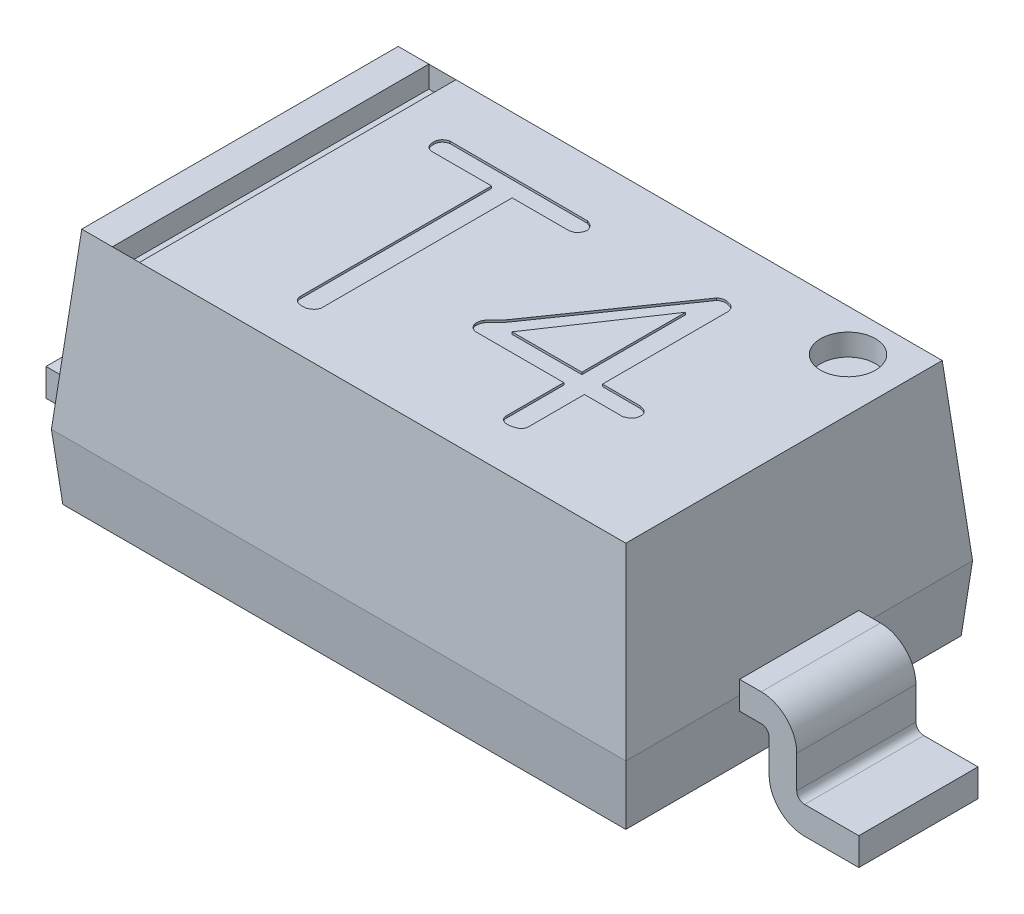
from build123d import *

# Parameters (mm, degrees)
SKETCH1_W                     = 2.65
SKETCH1_H                     = 1.6
BOSS_EXTRUDE1_DEPTH           = 0.8
BOSS_EXTRUDE1_TAPER           = 5
BOSS_EXTRUDE1_OTHER_WAY_DEPTH = 0.3
BOSS_EXTRUDE1_OTHER_WAY_TAPER = 5
EXTRUDE_THIN1_DEPTH           = 0.275
EXTRUDE_THIN1_2_DEPTH         = 0.275
CUT_EXTRUDE2_DEPTH            = 0.01
SKETCH5_R                     = 0.126365502
SKETCH5_R_2                   = 0.001365502
SKETCH5_W                     = 0.125
SKETCH5_H                     = 1.460018138
CUT_EXTRUDE_THIN1_DEPTH       = 0.1
CUT_EXTRUDE3_START            = 0.1
SKETCH6_R                     = 0.126365502
CUT_EXTRUDE3_DEPTH            = 0.1


with BuildPart() as part:
    # Sketch1 → Boss-Extrude1 (new body)
    with BuildSketch(Plane(origin=(0, 0, 0), x_dir=(1, 0, 0), z_dir=(0, 1, 0))):
        Rectangle(SKETCH1_W, SKETCH1_H)
    extrude(amount=BOSS_EXTRUDE1_DEPTH, taper=BOSS_EXTRUDE1_TAPER)

    # Sketch1 → Boss-Extrude1 other way (add)
    with BuildSketch(Plane(origin=(0, 0, 0), x_dir=(1, 0, 0), z_dir=(0, 1, 0))):
        Rectangle(SKETCH1_W, SKETCH1_H)
    extrude(amount=-BOSS_EXTRUDE1_OTHER_WAY_DEPTH, taper=BOSS_EXTRUDE1_OTHER_WAY_TAPER)

    # Sketch4 → Cut-Extrude2 (cut)
    # profile 1 of 2: a face of its own
    with BuildSketch(Plane(origin=(0, 0.8, 0), x_dir=(1, 0, 0), z_dir=(0, 1, 0))):
        with BuildLine():
            add(Edge.make_bspline(
                [(-0.121259144, 0.469586956), (-0.116651049, 0.467844685), (-0.107868449, 0.464524077), (-0.096447003, 0.45688116), (-0.088228357, 0.446516989), (-0.08521559, 0.438502857), (-0.083684739, 0.434430706)],
                knots=[0, 0, 0, 0, 1.099088096, 2.094759837, 3.031906972, 4, 4, 4, 4], degree=3))
            add(Edge.make_bspline(
                [(-0.083684739, 0.434430706), (-0.083934775, 0.43073761), (-0.084436505, 0.423326914), (-0.088624873, 0.412581115), (-0.095560362, 0.402540493), (-0.101669699, 0.396747659), (-0.104890096, 0.393694099)],
                knots=[0, 0, 0, 0, 0.933029919, 1.872250689, 2.878405478, 4, 4, 4, 4], degree=3))
            Line((-0.104890096, 0.393694099), (-0.124421346, 0.387741718))
            Line((-0.124421346, 0.387741718), (-0.386884144, 0.387741718))
            Line((-0.386884144, 0.387741718), (-0.386884144, -0.49488477))
            add(Edge.make_bspline(
                [(-0.386884144, -0.49488477), (-0.388226292, -0.49859483), (-0.390942509, -0.506103187), (-0.399133778, -0.515597253), (-0.40998304, -0.523599476), (-0.41870988, -0.527078256), (-0.423342477, -0.528924949)],
                knots=[0, 0, 0, 0, 0.906362302, 1.834280943, 2.850339336, 4, 4, 4, 4], degree=3))
            Line((-0.423342477, -0.528924949), (-0.44119962, -0.528924949))
            add(Edge.make_bspline(
                [(-0.44119962, -0.528924949), (-0.444004378, -0.528847963), (-0.449433668, -0.52869894), (-0.457185821, -0.526675103), (-0.464367422, -0.523841595), (-0.470465169, -0.519397714), (-0.475861843, -0.514357665), (-0.479352362, -0.507937944), (-0.481770348, -0.500885757), (-0.482001809, -0.495837361), (-0.482122239, -0.493210663)],
                knots=[0, 0, 0, 0, 1.101604685, 2.132423317, 3.139528337, 4.122044172, 5.089259853, 6.019369827, 6.969470802, 8, 8, 8, 8], degree=3))
            Line((-0.482122239, -0.493210663), (-0.482122239, 0.387741718))
            Line((-0.482122239, 0.387741718), (-0.757791882, 0.387741718))
            add(Edge.make_bspline(
                [(-0.757791882, 0.387741718), (-0.760480095, 0.388139413), (-0.765599748, 0.388896816), (-0.772640762, 0.391533578), (-0.778512088, 0.39530747), (-0.78335361, 0.400120388), (-0.787028717, 0.406002849), (-0.789960319, 0.412802663), (-0.791300872, 0.420801867), (-0.791526569, 0.426429317), (-0.791646049, 0.429408385)],
                knots=[0, 0, 0, 0, 1.08569211, 2.067680532, 2.983433341, 3.861048676, 4.776801484, 5.744887181, 6.80618505, 8, 8, 8, 8], degree=3))
            add(Edge.make_bspline(
                [(-0.791646049, 0.429408385), (-0.791584577, 0.432216594), (-0.791465245, 0.437668011), (-0.789266612, 0.445222233), (-0.786331556, 0.452128753), (-0.780251927, 0.459630268), (-0.770755063, 0.46725123), (-0.7615821, 0.469810155), (-0.757047834, 0.471075051)],
                knots=[0, 0, 0, 0, 0.852234277, 1.654394119, 2.381606146, 3.12243938, 4.577599788, 6, 6, 6, 6], degree=3))
            Line((-0.757047834, 0.471075051), (-0.121259144, 0.469586956))
        make_face()
    # profile 2 of 2: a face of its own
    with BuildSketch(Plane(origin=(0, 0.8, 0), x_dir=(1, 0, 0), z_dir=(0, 1, 0))):
        with BuildLine():
            Line((0.559544427, 0.448753623), (0.565496808, 0.43480273))
            Line((0.565496808, 0.43480273), (0.565496808, -0.147972568))
            Line((0.565496808, -0.147972568), (0.739975975, -0.14815858))
            add(Edge.make_bspline(
                [(0.739975975, -0.14815858), (0.745651472, -0.149356199), (0.756020301, -0.151544184), (0.769326, -0.158746004), (0.778601366, -0.169323965), (0.780500952, -0.178013221), (0.78145663, -0.18238477)],
                knots=[0, 0, 0, 0, 1.195577152, 2.184255469, 3.086502086, 4, 4, 4, 4], degree=3))
            add(Edge.make_bspline(
                [(0.78145663, -0.18238477), (0.781277252, -0.186567234), (0.780932587, -0.194603608), (0.777289425, -0.205957787), (0.771003906, -0.215812092), (0.765110859, -0.220779207), (0.762111392, -0.223307389)],
                knots=[0, 0, 0, 0, 1.063672196, 2.043787557, 3.004319249, 4, 4, 4, 4], degree=3))
            Line((0.762111392, -0.223307389), (0.74239413, -0.231305901))
            Line((0.74239413, -0.231305901), (0.565496808, -0.231305901))
            Line((0.565496808, -0.231305901), (0.565496808, -0.49581483))
            add(Edge.make_bspline(
                [(0.565496808, -0.49581483), (0.564260881, -0.498858107), (0.561887363, -0.504702527), (0.556262169, -0.51227222), (0.549055395, -0.518201234), (0.538078827, -0.522993434), (0.525678055, -0.526912801), (0.51597471, -0.528332493), (0.51192538, -0.528924949)],
                knots=[0, 0, 0, 0, 0.881479644, 1.692825178, 2.511522639, 3.362763725, 4.899447501, 6, 6, 6, 6], degree=3))
            add(Edge.make_bspline(
                [(0.51192538, -0.528924949), (0.508696109, -0.528823882), (0.502560844, -0.528631867), (0.493970227, -0.527060979), (0.486741308, -0.524145691), (0.480488563, -0.520558484), (0.47603653, -0.515232589), (0.472434762, -0.509147727), (0.470757032, -0.501724154), (0.470429882, -0.496501331), (0.470258713, -0.493768699)],
                knots=[0, 0, 0, 0, 1.244483934, 2.364384402, 3.340480475, 4.242091871, 5.105208837, 5.982430491, 6.944388035, 8, 8, 8, 8], degree=3))
            Line((0.470258713, -0.493768699), (0.470258713, -0.231305901))
            Line((0.470258713, -0.231305901), (0.063450677, -0.231305901))
            add(Edge.make_bspline(
                [(0.063450677, -0.231305901), (0.059452511, -0.230433032), (0.051747591, -0.228750916), (0.041794395, -0.222208098), (0.034174741, -0.212848085), (0.031417793, -0.205195004), (0.029968535, -0.201171972)],
                knots=[0, 0, 0, 0, 1.02115313, 1.96787762, 2.931764676, 4, 4, 4, 4], degree=3))
            Line((0.029968535, -0.201171972), (0.029782523, -0.191313341))
            add(Edge.make_bspline(
                [(0.029782523, -0.191313341), (0.030191147, -0.186555173), (0.031020816, -0.176894221), (0.035998822, -0.168567365), (0.038525082, -0.164341615)],
                knots=[0, 0, 0, 0, 0.985031118, 2, 2, 2, 2], degree=3))
            Line((0.038525082, -0.164341615), (0.088748297, -0.110584175))
            Line((0.088748297, -0.110584175), (0.48458163, 0.459356301))
            add(Edge.make_bspline(
                [(0.48458163, 0.459356301), (0.48706602, 0.461190918), (0.491766311, 0.464661884), (0.499344208, 0.468098846), (0.506495116, 0.470623481), (0.511285948, 0.470927998), (0.513599487, 0.471075051)],
                knots=[0, 0, 0, 0, 1.161393316, 2.197273816, 3.129445936, 4, 4, 4, 4], degree=3))
            add(Edge.make_bspline(
                [(0.513599487, 0.471075051), (0.515343337, 0.470935685), (0.519055223, 0.470639034), (0.522661923, 0.46970837), (0.524574189, 0.469214932)],
                knots=[0, 0, 0, 0, 0.939603003, 2, 2, 2, 2], degree=3))
            add(Edge.make_bspline(
                [(0.524574189, 0.469214932), (0.529087337, 0.468250248), (0.537249654, 0.466505554), (0.547784131, 0.462076394), (0.555743649, 0.456398213), (0.558340638, 0.45117483), (0.559544427, 0.448753623)],
                knots=[0, 0, 0, 0, 1.307248616, 2.364243258, 3.241773542, 4, 4, 4, 4], degree=3))
        make_face()
        Polygon((0.147900082, -0.147972568), (0.470258713, -0.147972568), (0.470258713, 0.330822075), align=None, mode=Mode.SUBTRACT)
    extrude(amount=-CUT_EXTRUDE2_DEPTH, mode=Mode.SUBTRACT)

    # Sketch5 → Cut-Extrude-Thin1 (cut)
    # profile 1 of 2: a face of its own
    with BuildSketch(Plane(origin=(0, 0.8, 0), x_dir=(1, 0, 0), z_dir=(0, 1, 0))):
        with Locations((1.013457904, 0.536885562)):
            Circle(SKETCH5_R)
        with Locations((1.013457904, 0.536885562)):
            Circle(SKETCH5_R_2, mode=Mode.SUBTRACT)
    # profile 2 of 2: a face of its own
    with BuildSketch(Plane(origin=(0, 0.8, 0), x_dir=(1, 0, 0), z_dir=(0, 1, 0))):
        with Locations((-1.051097793, 0)):
            Rectangle(SKETCH5_W, SKETCH5_H)
    extrude(amount=-CUT_EXTRUDE_THIN1_DEPTH, mode=Mode.SUBTRACT)

    # Sketch6 → Cut-Extrude3 (cut)
    with BuildSketch(Plane(origin=(0, 0.7, 0), x_dir=(1, 0, 0), z_dir=(0, 1, 0)).offset(CUT_EXTRUDE3_START)):
        with Locations((1.013457904, 0.536885562)):
            Circle(SKETCH6_R)
    extrude(amount=-CUT_EXTRUDE3_DEPTH, mode=Mode.SUBTRACT)


with BuildPart() as body_2:
    # Sketch3 → Extrude-Thin1 (new, symmetric)
    with BuildSketch(Plane.XY):
        with BuildLine():
            Line((-1.325, 0.06375), (-1.425, 0.06375))
            ThreePointArc((-1.425, 0.06375), (-1.540788735, 0.015788735), (-1.58875, -0.1))
            Line((-1.58875, -0.1), (-1.58875, -0.25))
            ThreePointArc((-1.58875, -0.25), (-1.599367379, -0.275632621), (-1.625, -0.28625))
            Line((-1.625, -0.28625), (-1.875, -0.28625))
            Line((-1.875, -0.28625), (-1.875, -0.41375))
            Line((-1.875, -0.41375), (-1.625, -0.41375))
            ThreePointArc((-1.625, -0.41375), (-1.509211265, -0.365788735), (-1.46125, -0.25))
            Line((-1.46125, -0.25), (-1.46125, -0.1))
            ThreePointArc((-1.46125, -0.1), (-1.450632621, -0.074367379), (-1.425, -0.06375))
            Line((-1.425, -0.06375), (-1.325, -0.06375))
            Line((-1.325, -0.06375), (-1.325, 0.06375))
        make_face()
    extrude(amount=EXTRUDE_THIN1_DEPTH, both=True)


with BuildPart() as body_3:
    # Sketch3 → Extrude-Thin1 2 (new, symmetric)
    with BuildSketch(Plane.XY):
        with BuildLine():
            Line((1.325, -0.06375), (1.425, -0.06375))
            ThreePointArc((1.425, -0.06375), (1.450632621, -0.074367379), (1.46125, -0.1))
            Line((1.46125, -0.1), (1.46125, -0.25))
            ThreePointArc((1.46125, -0.25), (1.509211265, -0.365788735), (1.625, -0.41375))
            Line((1.625, -0.41375), (1.875, -0.41375))
            Line((1.875, -0.41375), (1.875, -0.28625))
            Line((1.875, -0.28625), (1.625, -0.28625))
            ThreePointArc((1.625, -0.28625), (1.599367379, -0.275632621), (1.58875, -0.25))
            Line((1.58875, -0.25), (1.58875, -0.1))
            ThreePointArc((1.58875, -0.1), (1.540788735, 0.015788735), (1.425, 0.06375))
            Line((1.425, 0.06375), (1.325, 0.06375))
            Line((1.325, 0.06375), (1.325, -0.06375))
        make_face()
    extrude(amount=EXTRUDE_THIN1_2_DEPTH, both=True)


solid = Compound([part.part, body_2.part, body_3.part])
